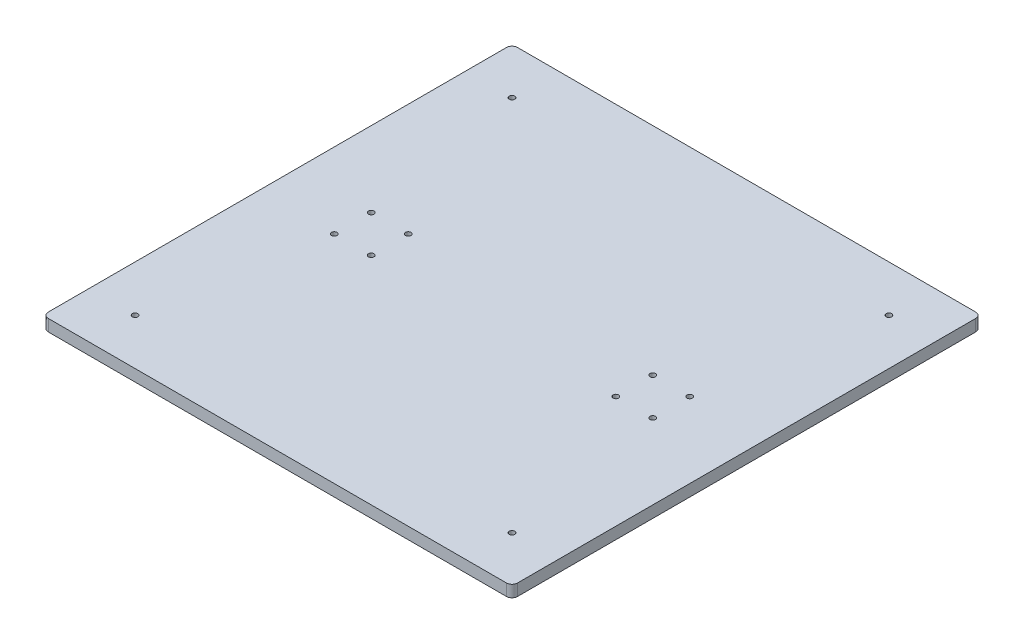
from build123d import *

# Parameters (mm, degrees)
BOSS_EXTRUDE1_DEPTH   = 6.35
F_3_0MM_DOWEL_HOLE1_D = 3
F_3_0MM_DOWEL_HOLE2_D = 3


with BuildPart() as part:
    # Sketch1 → Boss-Extrude1 (new body)
    with BuildSketch(Plane(origin=(0, 0, 0), x_dir=(1, 0, 0), z_dir=(0, 1, 0))):
        with BuildLine():
            Line((-124, 127), (124, 127))
            ThreePointArc((124, 127), (126.121320344, 126.121320344), (127, 124))
            Line((127, 124), (127, -124))
            ThreePointArc((127, -124), (126.121320344, -126.121320344), (124, -127))
            Line((124, -127), (-124, -127))
            ThreePointArc((-124, -127), (-126.121320344, -126.121320344), (-127, -124))
            Line((-127, -124), (-127, 124))
            ThreePointArc((-127, 124), (-126.121320344, 126.121320344), (-124, 127))
        make_face()
    extrude(amount=BOSS_EXTRUDE1_DEPTH)

    # Ø3.0mm Dowel Hole1 (through all)
    with Locations(Plane(origin=(0, 6.35, 0), x_dir=(1, 0, 0), z_dir=(0, 1, 0))):
        with Locations((-102, 102), (-102, -102), (102, -102), (102, 102)):
            Hole(F_3_0MM_DOWEL_HOLE1_D / 2)

    # Ø3.0mm Dowel Hole2 (through all)
    with Locations(Plane(origin=(0, 6.35, 0), x_dir=(1, 0, 0), z_dir=(0, 1, 0))):
        with Locations((66.2, 10), (-66.2, 10), (-66.2, -10), (-86.2, -10.025616853), (-86.2, 9.974383147), (86.2, 9.974383147), (86.2, -10.025616853), (66.2, -10)):
            Hole(F_3_0MM_DOWEL_HOLE2_D / 2)


solid = part.part
